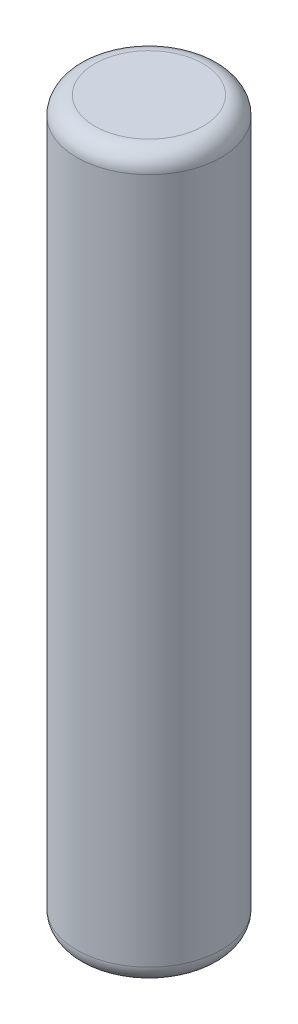
from build123d import *

# Parameters (mm, degrees)
SKETCH1_R           = 4
BOSS_EXTRUDE1_DEPTH = 40
FILLET1_R           = 1
SCALE1_SCALE        = 0.7


with BuildPart() as part:
    # Sketch1 → Boss-Extrude1 (new body)
    with BuildSketch(Plane(origin=(0, 0, 0), x_dir=(1, 0, 0), z_dir=(0, 1, 0))):
        with Locations(Location((0, 0, 0), (0, 0, 270))):
            Circle(SKETCH1_R)
    extrude(amount=BOSS_EXTRUDE1_DEPTH)

    # Fillet1
    fillet1_edges = [part.edges().sort_by_distance(p)[0] for p in [
        (0, 0, -4),
        (0, 40, -4),
    ]]
    fillet(fillet1_edges, radius=FILLET1_R)


with BuildPart() as part_1:
    # Scale1: scaled about (0, 20, 0)
    add(part.part.scale(SCALE1_SCALE).moved(Location((0, 6, 0))))


solid = part_1.part
